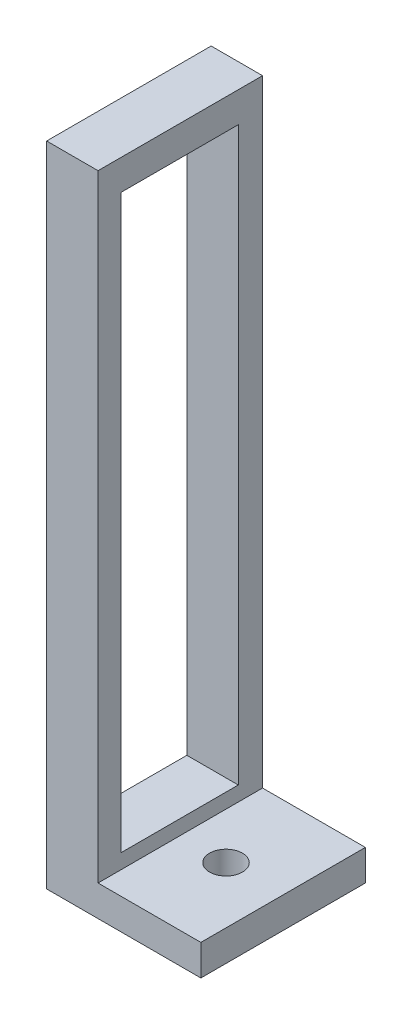
from build123d import *

# Parameters (mm, degrees)
EXTRUDE_1_DEPTH     = 16
SKETCH_2_W          = 11.421069603
SKETCH_2_H          = 55.615643281
CUT_EXTRUDE_1_DEPTH = 16
SKETCH_3_R          = 1.6
CUT_EXTRUDE_2_DEPTH = 16


with BuildPart() as part:
    # 草图1 → 凸台-拉伸1 (new body)
    with BuildSketch(Plane.XY):
        Polygon((0, 3), (0, 0), (5, 0), (15, 0), (15, 3), (5, 3), (5, 63), (0, 63), align=None)
    extrude(amount=EXTRUDE_1_DEPTH)

    # 草图2 → 切除-拉伸1 (cut)
    with BuildSketch(Plane(origin=(5, 0, 0), x_dir=(0, 0, -1), z_dir=(1, 0, 0))):
        with Locations((-8.070938321, 32.244852366)):
            Rectangle(SKETCH_2_W, SKETCH_2_H)
    extrude(amount=-CUT_EXTRUDE_1_DEPTH, mode=Mode.SUBTRACT)

    # 草图3 → 切除-拉伸2 (cut)
    with BuildSketch(Plane(origin=(0, 3, 0), x_dir=(1, 0, 0), z_dir=(0, 1, 0))):
        with Locations(Location((9.503642987, -8.058930676, 0), (0, 0, 270))):
            Circle(SKETCH_3_R)
    extrude(amount=-CUT_EXTRUDE_2_DEPTH, mode=Mode.SUBTRACT)


solid = part.part
